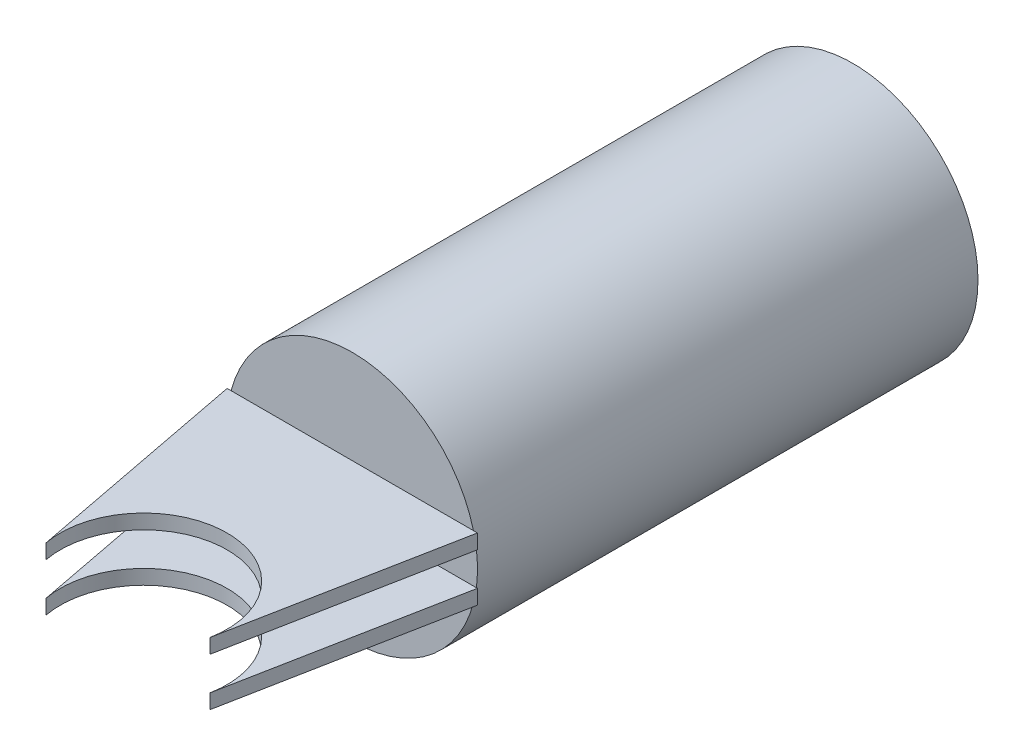
from build123d import *

# Parameters (mm, degrees)
POLE_SKETCH_R                   = 30
POLE_EXTRUDE_DEPTH              = 120
UPPER_START                     = 4
UPPER_PALM_HOLDER_EXTRUDE_DEPTH = 3.5
LOWER_START                     = -7.5
LOWER_PALM_HOLDER_EXTRUDE_DEPTH = 3.5


with BuildPart() as part:
    # Pole Sketch → Pole Extrude (new body)
    with BuildSketch(Plane.XY):
        Circle(POLE_SKETCH_R)
    extrude(amount=-POLE_EXTRUDE_DEPTH)

    # Palm Holder Sketch → Upper Palm Holder Extrude (add)
    with BuildSketch(Plane(origin=(0, 0, 0), x_dir=(1, 0, 0), z_dir=(0, 1, 0)).offset(UPPER_START)):
        with BuildLine():
            Line((19.63889875, -53.78333925), (30, 0))
            Line((30, 0), (-30, 0))
            Line((-30, 0), (-19.63889875, -53.78333925))
            ThreePointArc((-19.63889875, -53.78333925), (0, -30), (19.63889875, -53.78333925))
        make_face()
    extrude(amount=UPPER_PALM_HOLDER_EXTRUDE_DEPTH)

    # Palm Holder Sketch<2> → Lower Palm Holder Extrude (add)
    with BuildSketch(Plane(origin=(0, 0, 0), x_dir=(1, 0, 0), z_dir=(0, 1, 0)).offset(LOWER_START)):
        with BuildLine():
            Line((19.63889875, -53.78333925), (30, 0))
            Line((30, 0), (-30, 0))
            Line((-30, 0), (-19.63889875, -53.78333925))
            ThreePointArc((-19.63889875, -53.78333925), (0, -30), (19.63889875, -53.78333925))
        make_face()
    extrude(amount=LOWER_PALM_HOLDER_EXTRUDE_DEPTH)


solid = part.part
